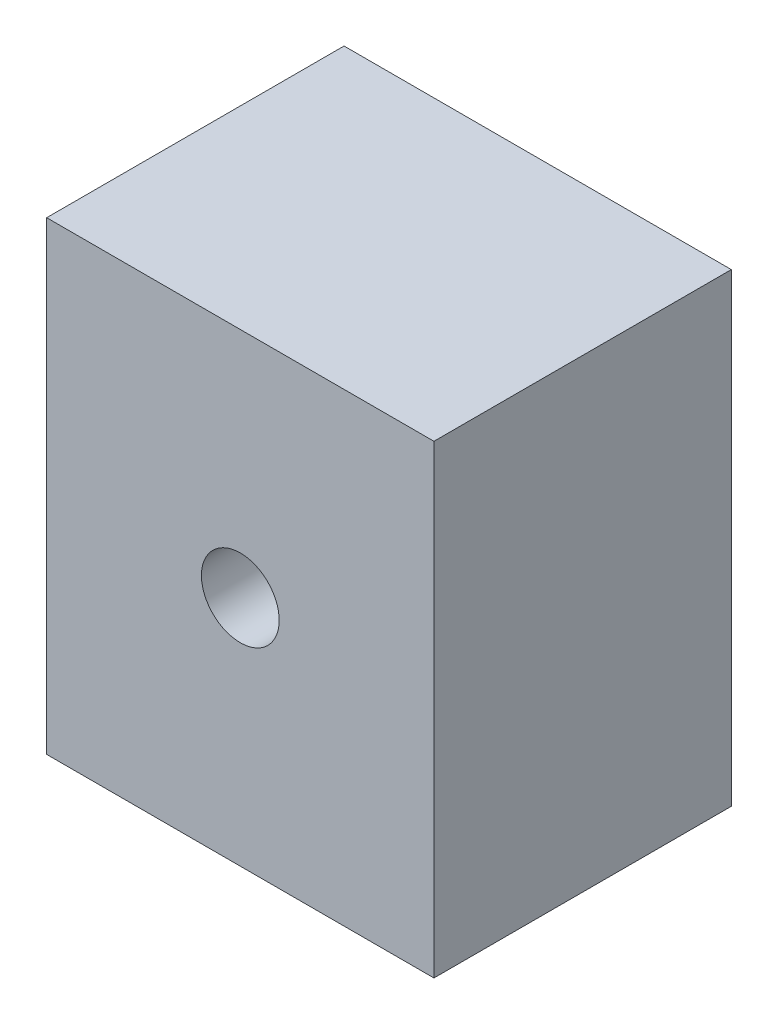
from build123d import *

# Parameters (mm, degrees)
SKETCH1_W           = 16.9288177
SKETCH1_H           = 13
BOSS_EXTRUDE1_DEPTH = 10.16
SKETCH2_R           = 1.7
CUT_EXTRUDE1_DEPTH  = 9.906
SKETCH2_3_R         = 1.7
CUT_EXTRUDE2_DEPTH  = 15.748


with BuildPart() as part:
    # Sketch1 → Boss-Extrude1 (new, symmetric)
    with BuildSketch(Plane(origin=(0, 0, 0), x_dir=(1, 0, 0), z_dir=(0, 1, 0))):
        with Locations((0, 3.5)):
            Rectangle(SKETCH1_W, SKETCH1_H)
    extrude(amount=BOSS_EXTRUDE1_DEPTH, both=True)

    # Sketch2 → Cut-Extrude1 (cut)
    with BuildSketch(Plane(origin=(0, 0, -10), x_dir=(-1, 0, 0), z_dir=(0, 0, -1))):
        Polygon((1.400074403, -2.425), (2.800148806, 0), (1.400074403, 2.425), (-1.400074403, 2.425), (-2.800148806, 0), (-1.400074403, -2.425), align=None)
        Circle(SKETCH2_R, mode=Mode.SUBTRACT)
    extrude(amount=-CUT_EXTRUDE1_DEPTH, mode=Mode.SUBTRACT)

    # Sketch2<3> → Cut-Extrude2 (cut)
    with BuildSketch(Plane(origin=(0, 0, -10), x_dir=(-1, 0, 0), z_dir=(0, 0, -1))):
        Circle(SKETCH2_3_R)
    extrude(amount=-CUT_EXTRUDE2_DEPTH, mode=Mode.SUBTRACT)


solid = part.part
